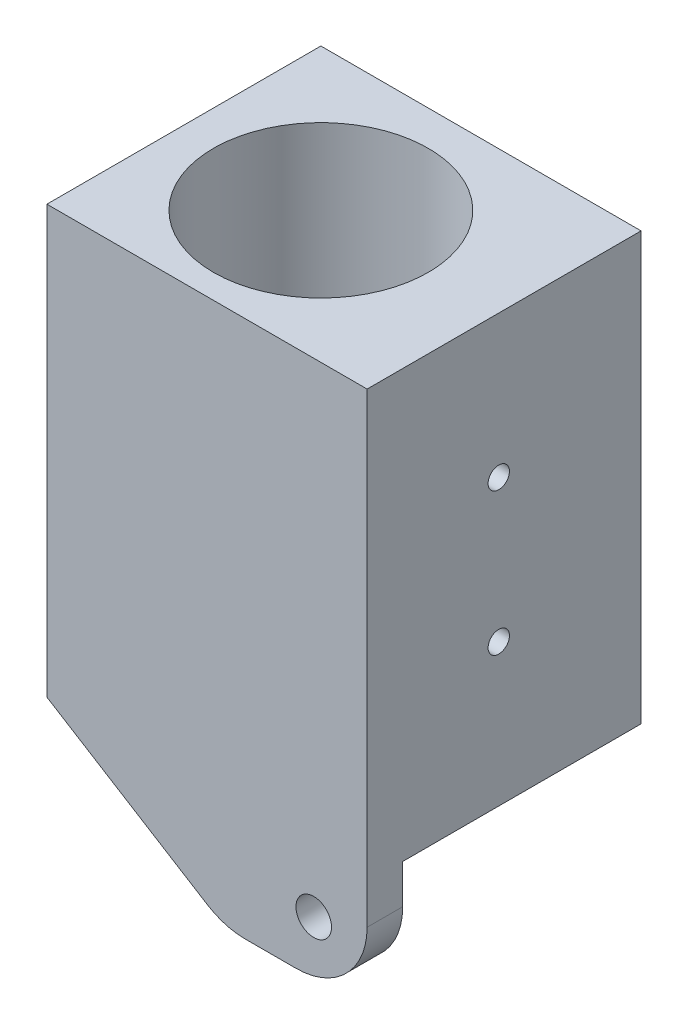
from build123d import *

# Parameters (mm, degrees)
SKETCH_1_W             = 45
SKETCH_1_H             = 38.5
EXTRUDE_1_DEPTH        = 60
SKETCH_2_R             = 15.1
CUT_EXTRUDE_1_DEPTH    = 50
SKETCH_3_R             = 2.5
EXTRUDE_2_DEPTH        = 5
SKETCH_4_R             = 1.5
CUT_EXTRUDE_2_DEPTH    = 78.620873481
PATTERN_LINEAR_1_COUNT = 2
PATTERN_LINEAR_1_PITCH = 20
FILLET_1_R             = 10


with BuildPart() as part:
    # 草圖1 → 填料-伸長1 (new body)
    with BuildSketch(Plane(origin=(0, 0, 0), x_dir=(1, 0, 0), z_dir=(0, 1, 0))):
        with Locations((2.5, 0.75)):
            Rectangle(SKETCH_1_W, SKETCH_1_H)
    extrude(amount=EXTRUDE_1_DEPTH)

    # 草圖2 → 除料-伸長1 (cut)
    with BuildSketch(Plane(origin=(0, 60, 0), x_dir=(1, 0, 0), z_dir=(0, 1, 0))):
        with Locations(Location((0, 0, 0), (0, 0, 270))):
            Circle(SKETCH_2_R)
    extrude(amount=-CUT_EXTRUDE_1_DEPTH, mode=Mode.SUBTRACT)

    # 草圖3 → 填料-伸長2 (add)
    with BuildSketch(Plane.XY.offset(18.5)):
        Polygon((-20, 0), (5, -15.5), (25, -15.5), (25, 0), align=None)
        with Locations((17.5, -8)):
            Circle(SKETCH_3_R, mode=Mode.SUBTRACT)
    extrude(amount=-EXTRUDE_2_DEPTH)

    # 草圖4 → 除料-伸長2 (cut, through all)
    with BuildSketch(Plane(origin=(25, 0, 0), x_dir=(0, 0, -1), z_dir=(1, 0, 0))):
        with Locations((0, 20)):
            Circle(SKETCH_4_R)
    cut_extrude_2 = extrude(amount=-CUT_EXTRUDE_2_DEPTH, mode=Mode.SUBTRACT)

    # 直線複製排列1: 除料-伸長2 ×2
    with Locations(*[(0, i * PATTERN_LINEAR_1_PITCH, 0) for i in range(1, PATTERN_LINEAR_1_COUNT)]):
        add(cut_extrude_2, mode=Mode.SUBTRACT)

    # 圓角1
    fillet_1_edges = [part.edges().sort_by_distance(p)[0] for p in [
        (25, -15.5, 16),
        (5, -15.5, 16),
    ]]
    fillet(fillet_1_edges, radius=FILLET_1_R)


solid = part.part
